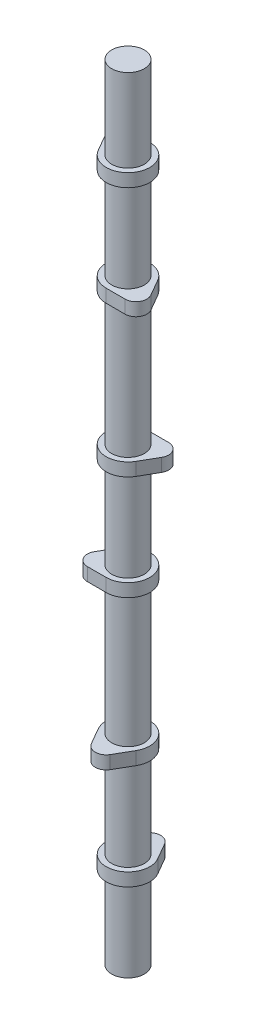
from build123d import *

# Parameters (mm, degrees)
BOSS_EXTRUDE1_DEPTH   = 3.81
LPATTERN1_COUNT       = 2
LPATTERN1_PITCH       = 60.96
BODY_MOVE_COPY1_ANGLE = 180
LPATTERN2_COUNT       = 3
LPATTERN2_PITCH       = 146.05
BODY_MOVE_COPY2_ANGLE = 120
BODY_MOVE_COPY3_ANGLE = 120
BOSS_EXTRUDE2_START   = -52.02
SKETCH2_R             = 9.5
BOSS_EXTRUDE2_DEPTH   = 457.15


with BuildPart() as part:
    # Sketch1 → Boss-Extrude1 (new, symmetric)
    with BuildSketch(Plane(origin=(0, 0, 0), x_dir=(1, 0, 0), z_dir=(0, 1, 0))):
        with BuildLine():
            Line((-5.499261314, 15.875), (-10.998522628, 6.35))
            ThreePointArc((-10.998522628, 6.35), (0, -12.7), (10.998522628, 6.35))
            Line((10.998522628, 6.35), (5.499261314, 15.875))
            ThreePointArc((5.499261314, 15.875), (0, 19.05), (-5.499261314, 15.875))
        make_face()
    extrude(amount=BOSS_EXTRUDE1_DEPTH, both=True)


with BuildPart() as lpattern1_1:
    # LPattern1: pattern copy
    add(part.part.moved(Location(Vector(0, 1, 0) * (1 * LPATTERN1_PITCH))))


with BuildPart() as lpattern1_1_1:
    # Body-Move/Copy1: moved
    add(lpattern1_1.part.rotate(Axis((0, 0, 0), (0, 1, 0)), BODY_MOVE_COPY1_ANGLE))


with BuildPart() as lpattern2_1:
    # LPattern2: pattern copy
    add(part.part.moved(Location(Vector(0, 1, 0) * (1 * LPATTERN2_PITCH))))


with BuildPart() as lpattern2_2:
    # LPattern2: pattern copy
    add(part.part.moved(Location(Vector(0, 1, 0) * (2 * LPATTERN2_PITCH))))


with BuildPart() as lpattern2_3:
    # LPattern2: pattern copy
    add(lpattern1_1_1.part.moved(Location(Vector(0, 1, 0) * (1 * LPATTERN2_PITCH))))


with BuildPart() as lpattern2_4:
    # LPattern2: pattern copy
    add(lpattern1_1_1.part.moved(Location(Vector(0, 1, 0) * (2 * LPATTERN2_PITCH))))


with BuildPart() as lpattern2_1_1:
    # Body-Move/Copy2: moved
    add(lpattern2_1.part.rotate(Axis((0, 0, 0), (0, 1, 0)), BODY_MOVE_COPY2_ANGLE))


with BuildPart() as lpattern2_3_1:
    # Body-Move/Copy2: moved
    add(lpattern2_3.part.rotate(Axis((0, 0, 0), (0, 1, 0)), BODY_MOVE_COPY2_ANGLE))


with BuildPart() as lpattern2_4_1:
    # Body-Move/Copy3: moved
    add(lpattern2_4.part.rotate(Axis((0, 0, 0), (0, -1, 0)), BODY_MOVE_COPY3_ANGLE))


with BuildPart() as lpattern2_2_1:
    # Body-Move/Copy3: moved
    add(lpattern2_2.part.rotate(Axis((0, 0, 0), (0, -1, 0)), BODY_MOVE_COPY3_ANGLE))


with BuildPart() as part_1:
    add(part.part)

    add(lpattern1_1_1.part)  # Boss-Extrude2 merges LPattern1_1

    add(lpattern2_1_1.part)  # Boss-Extrude2 merges LPattern2_1

    add(lpattern2_2_1.part)  # Boss-Extrude2 merges LPattern2_2

    add(lpattern2_3_1.part)  # Boss-Extrude2 merges LPattern2_3

    add(lpattern2_4_1.part)  # Boss-Extrude2 merges LPattern2_4
    # Sketch2 → Boss-Extrude2 (add)
    with BuildSketch(Plane(origin=(0, 0, 0), x_dir=(1, 0, 0), z_dir=(0, 1, 0)).offset(BOSS_EXTRUDE2_START)):
        Circle(SKETCH2_R)
    extrude(amount=BOSS_EXTRUDE2_DEPTH)


solid = part_1.part
